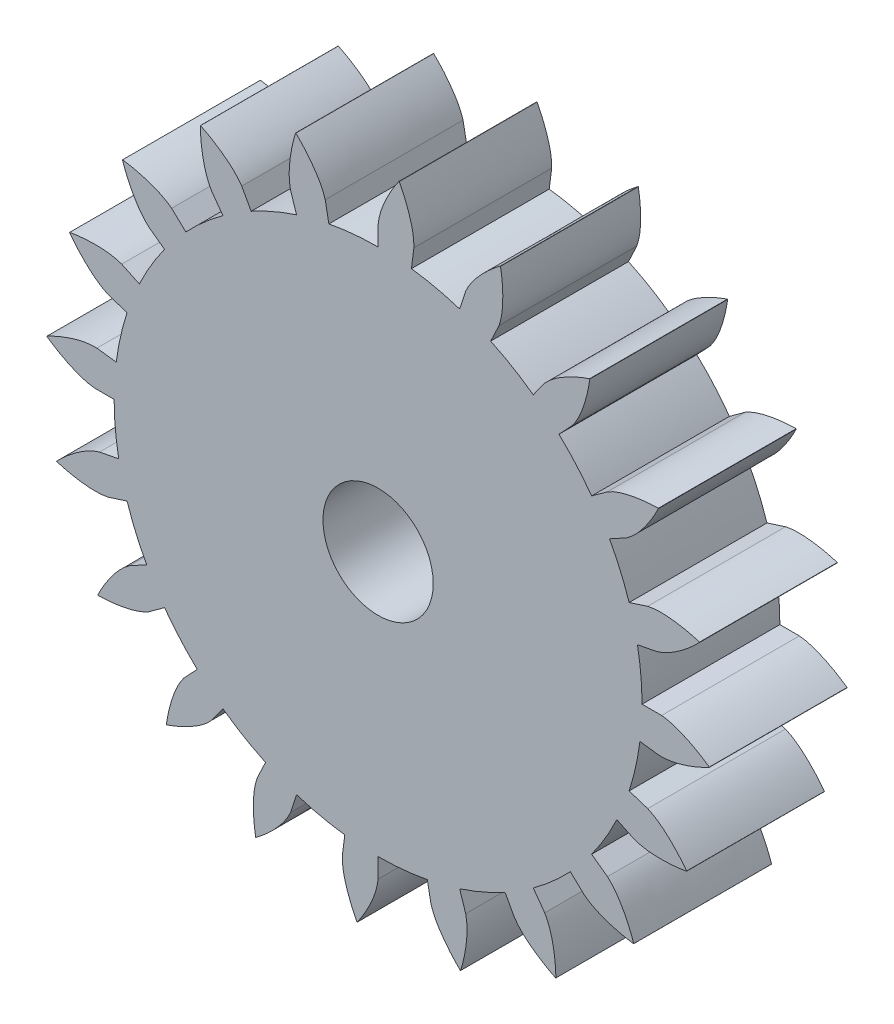
from build123d import *

# Parameters (mm, degrees)
BOSS_EXTRUDE7_DEPTH = 15
CIRPATTERN2_COUNT   = 20


with BuildPart() as part:
    # Sketch7 → Boss-Extrude7 (new body)
    with BuildSketch(Plane.XY):
        with BuildLine():
            add(Edge.make_bspline(
                [(0, 30.854687509), (0.084476453, 31.705685381), (0.701122754, 33.531656477), (1.663731148, 35.184454672), (2.27061695, 36.046632731)],
                knots=[0, 0, 0, 0, 0.25007431, 0.558678313, 0.558678313, 0.558678313, 0.558678313], degree=3))
            Line((0, 30.854687509), (0, 28.730287933))
            ThreePointArc((0, 28.730287933), (1.817094383, 28.672767789), (3.626912853, 28.500437678))
            Line((3.626912853, 28.500437678), (3.895097152, 30.60784147))
            add(Edge.make_bspline(
                [(3.895097152, 30.60784147), (3.918726544, 31.462695435), (3.537524258, 33.351903714), (2.791266317, 35.112998793), (2.298077167, 36.044892481)],
                knots=[0, 0, 0, 0, 0.25007431, 0.558678313, 0.558678313, 0.558678313, 0.558678313], degree=3))
            ThreePointArc((2.298077167, 36.044892481), (2.284347224, 36.045765221), (2.27061695, 36.046632731))
        make_face()
        with BuildLine():
            ThreePointArc((3.626912853, 28.500437678), (1.817094383, 28.672767789), (0, 28.730287933))
            Line((0, 28.730287933), (0, 6))
            ThreePointArc((0, 6), (0.379479883, 5.98798756), (0.757440272, 5.95199834))
            Line((0.757440272, 5.95199834), (3.626912853, 28.500437678))
        make_face()
        with BuildLine():
            Line((0, 6), (0, 28.730287933))
            ThreePointArc((0, 28.730287933), (-20.315381423, -20.315381423), (28.730287933, 0))
            ThreePointArc((28.730287933, 0), (21.559588299, 18.989828779), (3.626912853, 28.500437678))
            Line((3.626912853, 28.500437678), (0.757440272, 5.95199834))
            ThreePointArc((0.757440272, 5.95199834), (4.502479408, 3.965813811), (6, 0))
            ThreePointArc((6, 0), (-4.242640687, -4.242640687), (0, 6))
        make_face()
    boss_extrude7 = extrude(amount=BOSS_EXTRUDE7_DEPTH)

    # CirPattern2: Boss-Extrude7 ×20 about axis
    cirpattern2_axis = Axis((0, 0, 15), (0, 0, -1))
    for i in range(1, CIRPATTERN2_COUNT):
        add(boss_extrude7.rotate(cirpattern2_axis, i * 360 / CIRPATTERN2_COUNT))


solid = part.part
